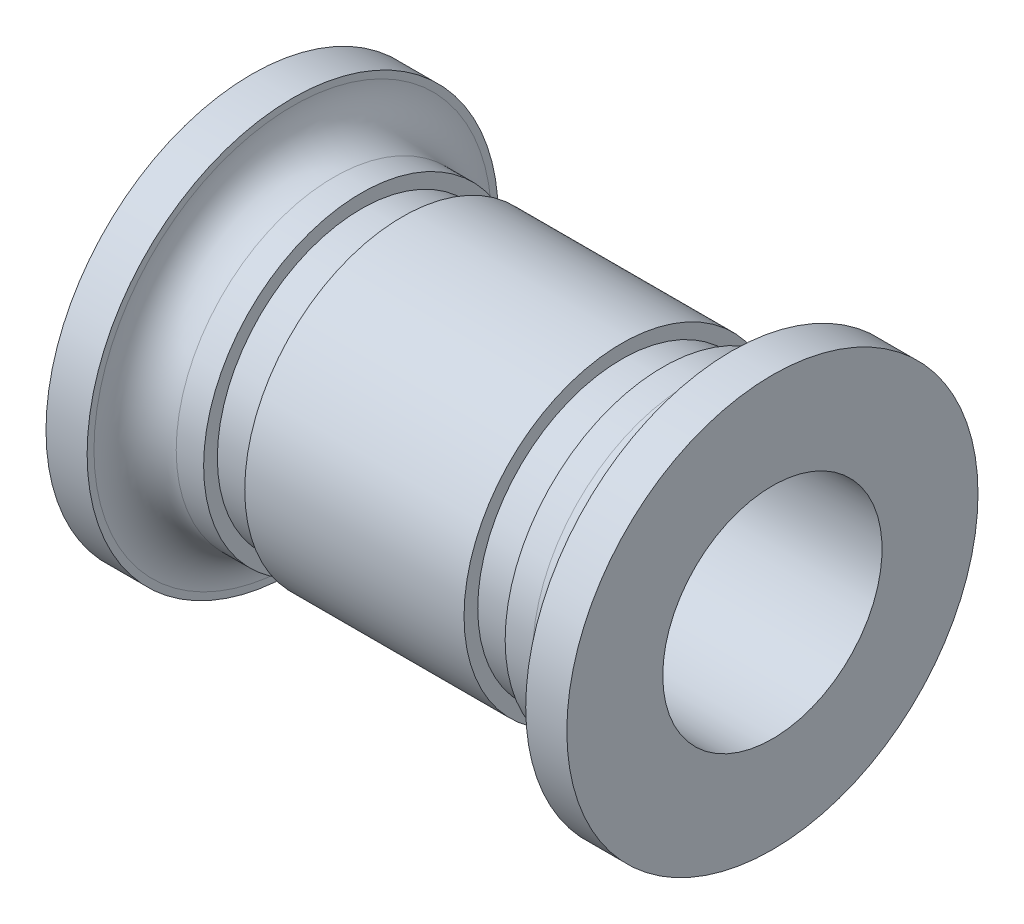
from build123d import *


with BuildPart() as part:
    # Esquisse2 → Révolution1 (revolve)
    with BuildSketch(Plane.XY, mode=Mode.PRIVATE) as r_volution1_sk:
        with BuildLine():
            Line((380, 150), (380, 80))
            Line((380, 80), (0, 80))
            Line((0, 80), (0, 150))
            Line((0, 150), (30, 150))
            Line((30, 150), (30, 145))
            ThreePointArc((30, 145), (38.786796564, 123.786796564), (60, 115))
            Line((60, 115), (80, 115))
            Line((80, 115), (80, 105))
            Line((80, 105), (110, 105))
            Line((110, 105), (110, 115))
            Line((110, 115), (270, 115))
            Line((270, 115), (270, 105))
            Line((270, 105), (300, 105))
            Line((300, 105), (300, 115))
            Line((300, 115), (320, 115))
            ThreePointArc((320, 115), (341.213203436, 123.786796564), (350, 145))
            Line((350, 145), (350, 150))
            Line((350, 150), (380, 150))
        make_face()
    revolve(r_volution1_sk.sketch.rotate(Axis((0, 0, 0), (1, 0, 0)), 90), axis=Axis((0, 0, 0), (1, 0, 0)))


solid = part.part
